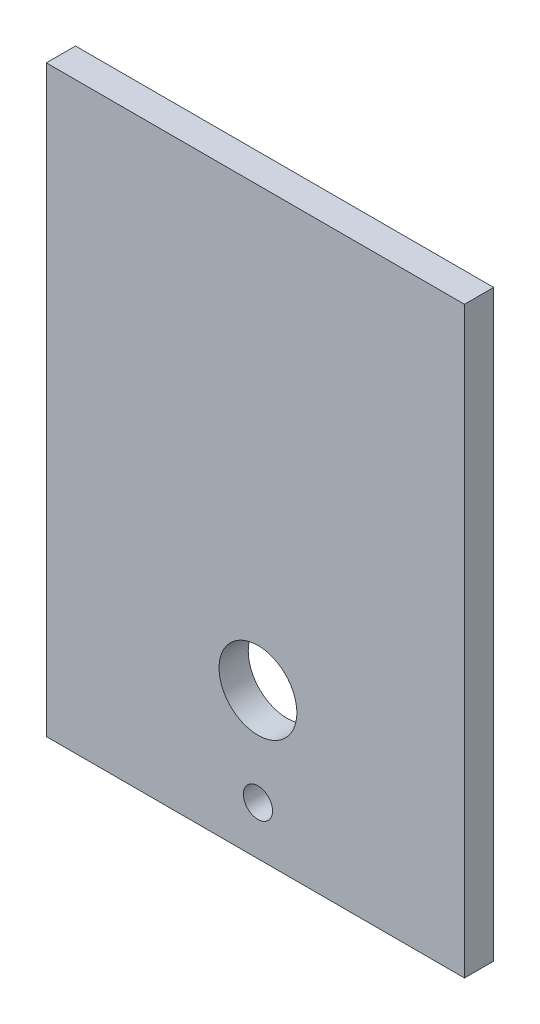
from build123d import *

# Parameters (mm, degrees)
SKETCH1_W           = 1092.2
SKETCH1_H           = 1524
SKETCH1_R           = 101.6
SKETCH1_R_2         = 38.1
BOSS_EXTRUDE1_DEPTH = 76.2


with BuildPart() as part:
    # Sketch1 → Boss-Extrude1 (new body)
    with BuildSketch(Plane.XY):
        with Locations((546.1, 762)):
            Rectangle(SKETCH1_W, SKETCH1_H)
        with Locations(Location((552.718036359, 381, 0), (0, 0, 180))):
            Circle(SKETCH1_R, mode=Mode.SUBTRACT)
        with Locations(Location((552.718036359, 127, 0), (0, 0, 180))):
            Circle(SKETCH1_R_2, mode=Mode.SUBTRACT)
    extrude(amount=BOSS_EXTRUDE1_DEPTH)


solid = part.part
